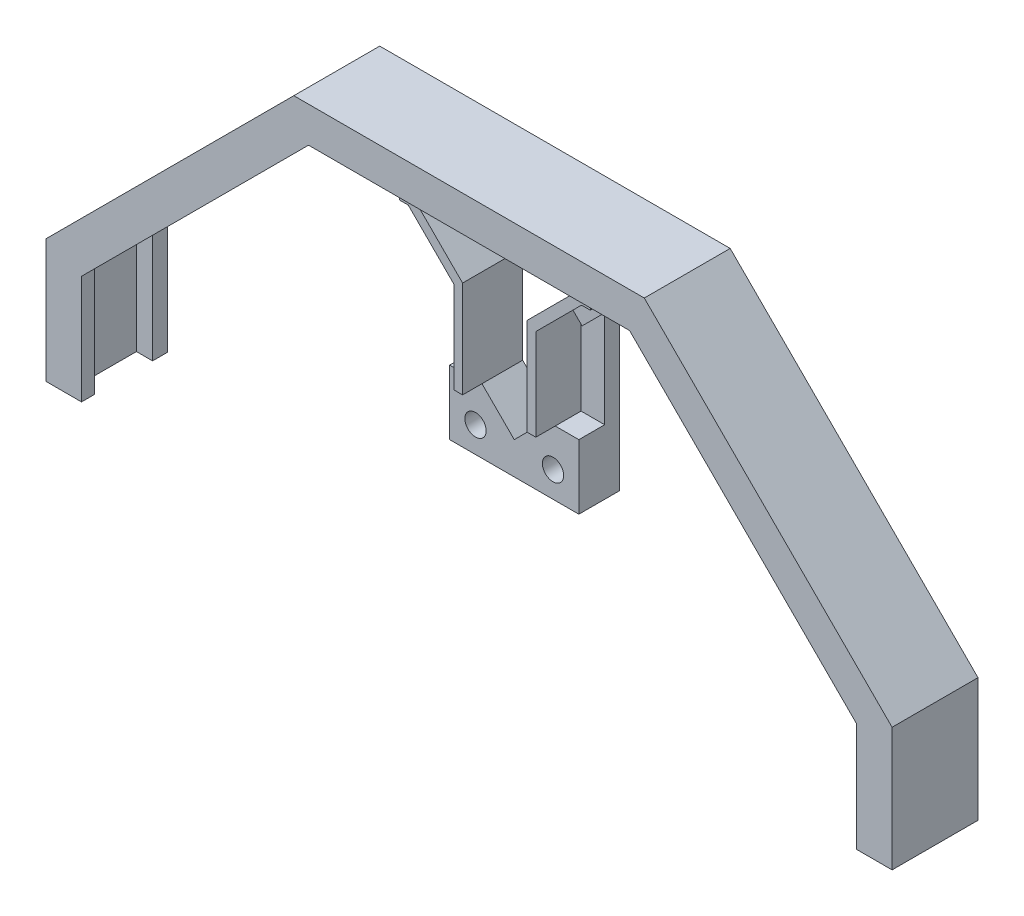
from build123d import *

# Parameters (mm, degrees)
ESBO_O4_R                = 1.65
RESSALTO_EXTRUS_O1_DEPTH = 2.3
RESSALTO_EXTRUS_O2_DEPTH = 3.5
RESSALTO_EXTRUS_O3_DEPTH = 11
CORTE_EXTRUS_O1_DEPTH    = 10.5
CORTE_EXTRUS_O2_DEPTH    = 40.5
RESSALTO_EXTRUS_O4_DEPTH = 2
CHANFRO1_SIZE            = 1
ESBO_O11_R               = 1.65
RESSALTO_EXTRUS_O5_DEPTH = 4
RESSALTO_EXTRUS_O6_DEPTH = 7


with BuildPart() as part:
    # Esboço4 → Ressalto-extrusão1 (new body)
    with BuildSketch(Plane.XY):
        Polygon((70, 0), (70, 28.994949366), (28.994949366, 70), (-28.994949366, 70), (-70, 28.994949366), (-70, 0), (-60, 0), (-60, 24.852813742), (-42.426406871, 42.426406871), (-31.166522241, 53.686291501), (-14.242640687, 53.686291501), (-10, 49.443650814), (-10, 24.443650814), (10, 24.443650814), (10, 49.443650814), (14.242640687, 53.686291501), (31.166522241, 53.686291501), (42.426406871, 42.426406871), (60, 24.852813742), (60, 0), align=None)
        with Locations((6, 28.443650814)):
            Circle(ESBO_O4_R, mode=Mode.SUBTRACT)
        with Locations(Location((-6, 28.443650814, 0), (0, 0, 180))):
            Circle(ESBO_O4_R, mode=Mode.SUBTRACT)
        Polygon((-9.894556364, 62.105443636), (9.894556364, 62.105443636), (12.778174593, 59.221825407), (12.778174593, 57.221825407), (5, 49.443650814), (5, 34.443650814), (0, 29.443650814), (-5, 34.443650814), (-5, 49.443650814), (-12.778174593, 57.221825407), (-12.778174593, 59.221825407), align=None, mode=Mode.SUBTRACT)
    extrude(amount=RESSALTO_EXTRUS_O1_DEPTH)

    # Esboço6 → Ressalto-extrusão2 (add)
    with BuildSketch(Plane.XY.offset(2.3)):
        Polygon((-10, 49.443650814), (-14.242640687, 53.686291501), (-31.166522241, 53.686291501), (-35.409162928, 49.443650814), (-36.823376491, 50.857864376), (-31.994949366, 55.686291501), (-31.166522241, 55.686291501), (-13.414213562, 55.686291501), (-8.585786438, 50.857864376), align=None)
        Polygon((8.585786438, 50.857864376), (13.414213562, 55.686291501), (31.166522241, 55.686291501), (31.994949366, 55.686291501), (36.823376491, 50.857864376), (35.409162928, 49.443650814), (31.166522241, 53.686291501), (14.242640687, 53.686291501), (10, 49.443650814), align=None)
    extrude(amount=RESSALTO_EXTRUS_O2_DEPTH)

    # Esboço7 → Ressalto-extrusão3 (add)
    with BuildSketch(Plane.XY.offset(2.3)):
        Polygon((27.130988335, 65.5), (-27.130988335, 65.5), (-65.5, 27.130988335), (-65.5, 0), (-62.5, 0), (-62.5, 25.888347648), (-25.888347648, 62.5), (25.888347648, 62.5), (62.5, 25.888347648), (62.5, 0), (65.5, 0), (65.5, 27.130988335), align=None)
    extrude(amount=RESSALTO_EXTRUS_O3_DEPTH)

    # Esboço8 → Corte-extrusão1 (cut)
    with BuildSketch(Plane.XY.offset(2.3)):
        Polygon((-65.5, 0), (-65.5, 27.130988335), (-27.130988335, 65.5), (27.130988335, 65.5), (65.5, 27.130988335), (65.5, 0), (65.5, -7.47317723), (91.763905533, -7.47317723), (91.763905533, 81.084833901), (-91.763905533, 81.084833901), (-91.763905533, -7.47317723), (-65.5, -7.47317723), align=None)
    extrude(amount=-CORTE_EXTRUS_O1_DEPTH, mode=Mode.SUBTRACT)

    # Esboço9 → Corte-extrusão2 (cut)
    with BuildSketch(Plane(origin=(0, 0, 0), x_dir=(-1, 0, 0), z_dir=(0, 0, -1))):
        Polygon((60, 0), (70, 0), (70, 8.000623443), (-93.298268705, 8.000623443), (-93.298268705, 0), align=None)
    extrude(amount=-CORTE_EXTRUS_O2_DEPTH, mode=Mode.SUBTRACT)

    # Esboço10 → Ressalto-extrusão4 (add)
    with BuildSketch(Plane.XY.offset(13.3)):
        Polygon((-62.5, 8.000623443), (-62.5, 25.888347648), (-25.888347648, 62.5), (25.888347648, 62.5), (62.5, 25.888347648), (62.5, 8.000623443), (60, 8.000623443), (60, 24.852813742), (24.852813742, 60), (-24.852813742, 60), (-60, 24.852813742), (-60, 8.000623443), align=None)
    extrude(amount=-RESSALTO_EXTRUS_O4_DEPTH)

    # Chanfro1
    chanfro1_edges = [part.edges().sort_by_distance(p)[0] for p in [
        (-62.5, 16.944485546, 11.3),
        (-44.194173824, 44.194173824, 11.3),
        (0, 62.5, 11.3),
        (44.194173824, 44.194173824, 11.3),
        (62.5, 16.944485546, 11.3),
    ]]
    chamfer(chanfro1_edges, length=CHANFRO1_SIZE)

    # Esboço11 → Ressalto-extrusão5 (add)
    with BuildSketch(Plane.XY.offset(2.3)):
        Polygon((-10, 24.443650814), (10, 24.443650814), (10, 34.443650814), (5, 34.443650814), (0, 29.443650814), (-5, 34.443650814), (-10, 34.443650814), align=None)
        with Locations(Location((-6, 28.443650814, 0), (0, 0, 180))):
            Circle(ESBO_O11_R, mode=Mode.SUBTRACT)
        with Locations((6, 28.443650814)):
            Circle(ESBO_O11_R, mode=Mode.SUBTRACT)
    extrude(amount=RESSALTO_EXTRUS_O5_DEPTH)

    # Esboço12 → Ressalto-extrusão6 (add)
    with BuildSketch(Plane.XY.offset(2.3)):
        Polygon((-5, 34.443650814), (-5, 49.443650814), (-12.778174593, 57.221825407), (-12.778174593, 62.936367936), (-14.778174593, 62.936367936), (-14.778174593, 55.686291501), (-13.414213562, 55.686291501), (-6.343145751, 48.615223689), (-6.343145751, 34.443650814), align=None)
        Polygon((6.343145751, 34.443650814), (5, 34.443650814), (5, 49.443650814), (12.778174593, 57.221825407), (12.778174593, 62.936367936), (14.778174593, 62.936367936), (14.778174593, 55.686291501), (13.414213562, 55.686291501), (6.343145751, 48.615223689), align=None)
    extrude(amount=RESSALTO_EXTRUS_O6_DEPTH)


solid = part.part
